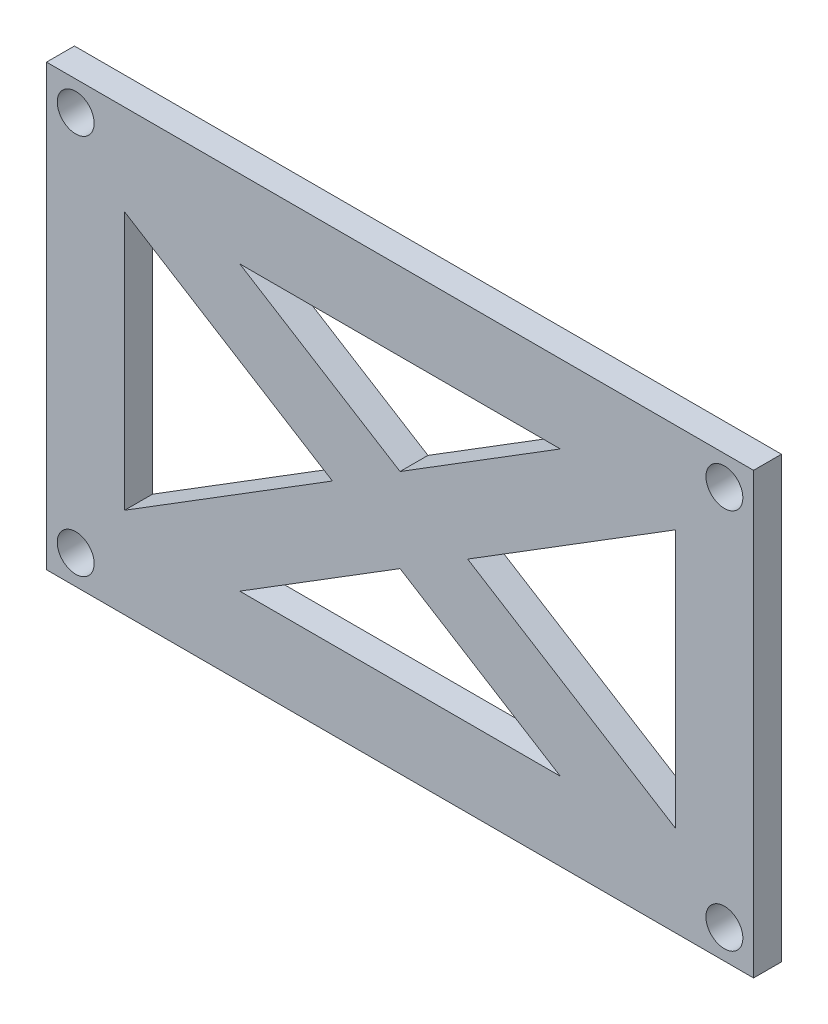
from build123d import *

# Parameters (mm, degrees)
SKETCH2_W           = 40.2336
SKETCH2_H           = 25.019
SKETCH2_R           = 1.05
BOSS_EXTRUDE1_DEPTH = 1.5875


with BuildPart() as part:
    # Sketch2 → Boss-Extrude1 (new body)
    with BuildSketch(Plane.XY):
        Rectangle(SKETCH2_W, SKETCH2_H)
        with Locations((-18.4568, 10.8495)):
            Circle(SKETCH2_R, mode=Mode.SUBTRACT)
        with Locations(Location((-18.4568, -10.8495, 0), (0, 0, 180))):
            Circle(SKETCH2_R, mode=Mode.SUBTRACT)
        with Locations((18.4568, -10.8495)):
            Circle(SKETCH2_R, mode=Mode.SUBTRACT)
        with Locations(Location((18.4568, 10.8495, 0), (0, 0, 180))):
            Circle(SKETCH2_R, mode=Mode.SUBTRACT)
        Polygon((15.6718, -7.352568033), (3.847974859, 0), (15.6718, 7.352568033), align=None, mode=Mode.SUBTRACT)
        Polygon((9.120723619, -8.0645), (0, -2.392837901), (-9.120723619, -8.0645), align=None, mode=Mode.SUBTRACT)
        Polygon((9.120723619, 8.0645), (-9.120723619, 8.0645), (0, 2.392837901), align=None, mode=Mode.SUBTRACT)
        Polygon((-15.6718, 7.352568033), (-15.6718, -7.352568033), (-3.847974859, 0), align=None, mode=Mode.SUBTRACT)
    extrude(amount=BOSS_EXTRUDE1_DEPTH)


solid = part.part
